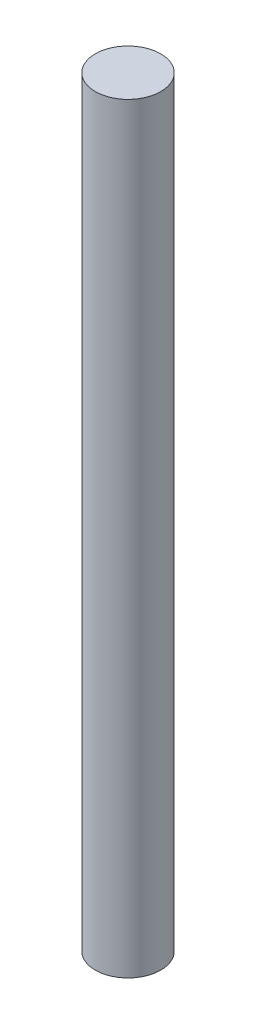
from build123d import *

# Parameters (mm, degrees)
SKETCH1_R           = 3.2766
BOSS_EXTRUDE1_DEPTH = 76.2


with BuildPart() as part:
    # Sketch1 → Boss-Extrude1 (new body)
    with BuildSketch(Plane(origin=(0, 0, 0), x_dir=(1, 0, 0), z_dir=(0, 1, 0))):
        Circle(SKETCH1_R)
    extrude(amount=BOSS_EXTRUDE1_DEPTH)


solid = part.part
